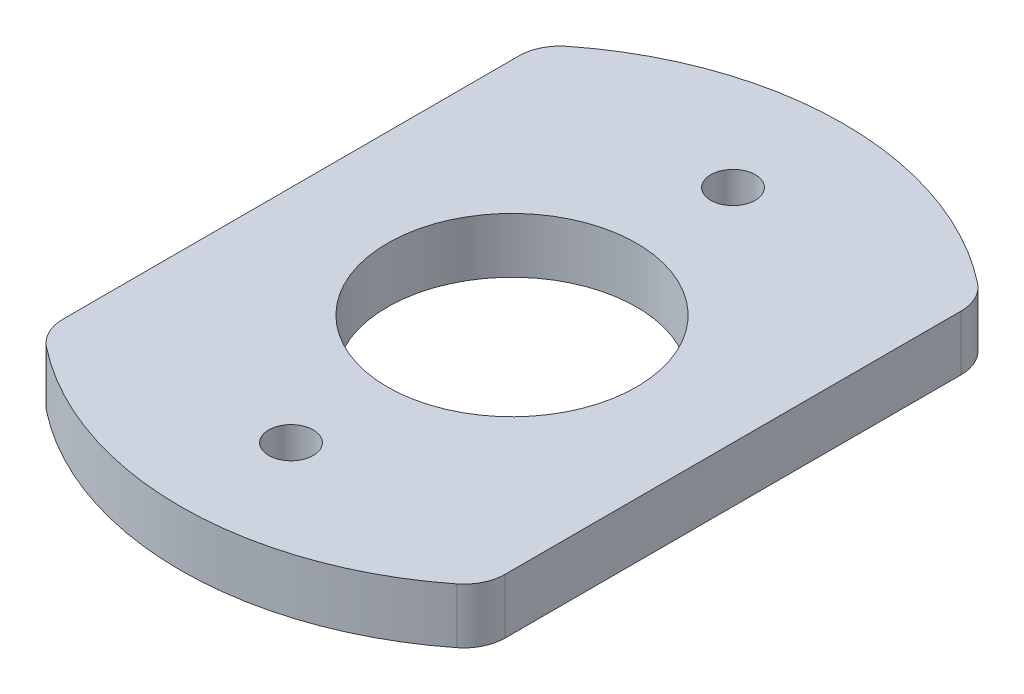
from build123d import *

# Parameters (mm, degrees)
SKETCH1_R              = 38.1
SKETCH1_R_2            = 14.3129
BOSS_EXTRUDE1_DEPTH    = 6.35
SKETCH4_OUTSIDE_W      = 99.79
SKETCH4_OUTSIDE_H      = 99.79
CUT_EXTRUDE1_DEPTH     = 55.254423783
F_10_CLEARANCE_HOLE2_D = 5.1054


with BuildPart() as part:
    # Sketch1 → Boss-Extrude1 (new body)
    with BuildSketch(Plane(origin=(0, 0, 0), x_dir=(1, 0, 0), z_dir=(0, 1, 0))):
        with Locations(Location((0, 0, 0), (0, 0, 270))):
            Circle(SKETCH1_R)
        with Locations(Location((0, 0, 0), (0, 0, 270))):
            Circle(SKETCH1_R_2, mode=Mode.SUBTRACT)
    extrude(amount=BOSS_EXTRUDE1_DEPTH)

    # Sketch4 outside → Cut-Extrude1 (cut, through all)
    with BuildSketch(Plane(origin=(0, 6.35, 0), x_dir=(1, 0, 0), z_dir=(0, 1, 0))):
        Rectangle(SKETCH4_OUTSIDE_W, SKETCH4_OUTSIDE_H)
        with BuildLine():
            Line((-25.4, -26.181720723), (-25.4, 26.181720723))
            ThreePointArc((-25.4, 26.181720723), (-24.922489894, 28.260246127), (-23.585714286, 29.92196654))
            ThreePointArc((-23.585714286, 29.92196654), (0, 38.1), (23.585714286, 29.92196654))
            ThreePointArc((23.585714286, 29.92196654), (24.922489894, 28.260246127), (25.4, 26.181720723))
            Line((25.4, 26.181720723), (25.4, -26.181720723))
            ThreePointArc((25.4, -26.181720723), (24.922489894, -28.260246127), (23.585714286, -29.92196654))
            ThreePointArc((23.585714286, -29.92196654), (0, -38.1), (-23.585714286, -29.92196654))
            ThreePointArc((-23.585714286, -29.92196654), (-24.922489894, -28.260246127), (-25.4, -26.181720723))
        make_face(mode=Mode.SUBTRACT)
    extrude(amount=-CUT_EXTRUDE1_DEPTH, mode=Mode.SUBTRACT)

    # #10 Clearance Hole2 (through all)
    with Locations(Plane(origin=(0, 6.35, 0), x_dir=(1, 0, 0), z_dir=(0, 1, 0))):
        with Locations((0, 25.4), (0, -25.4)):
            Hole(F_10_CLEARANCE_HOLE2_D / 2)


solid = part.part
